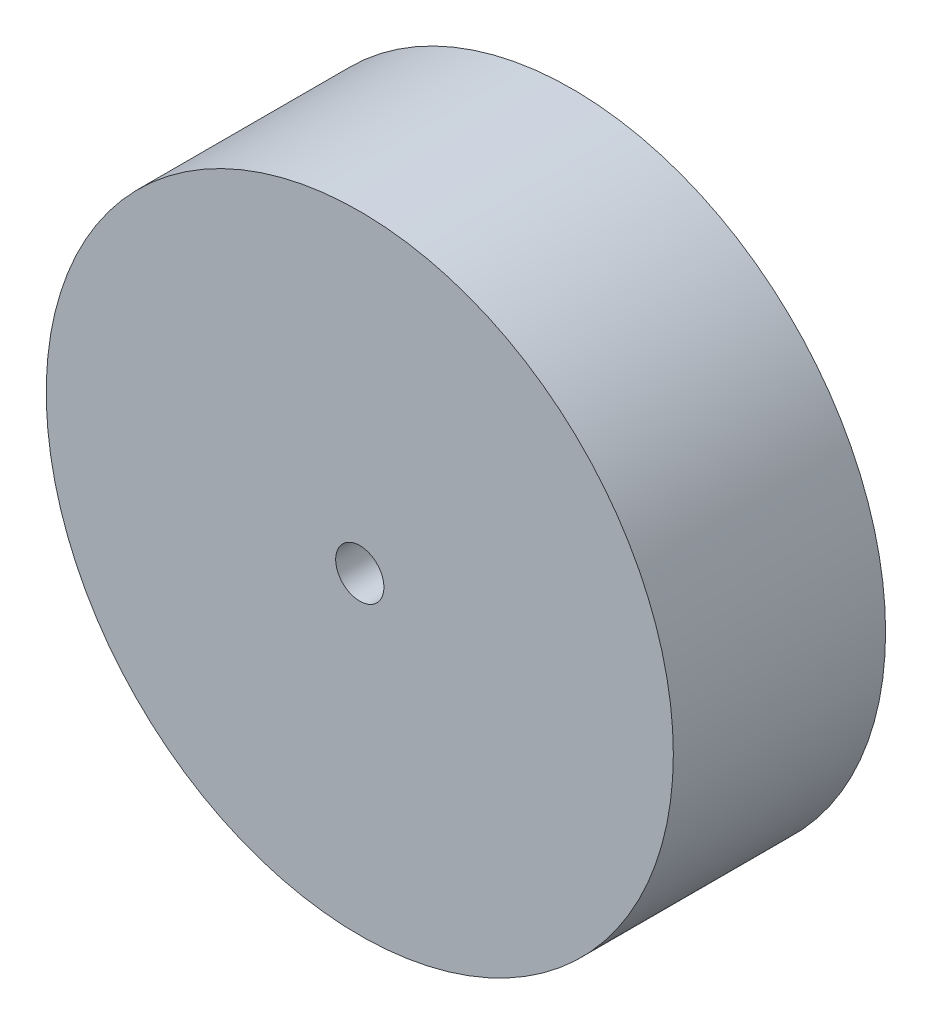
from build123d import *

# Parameters (mm, degrees)
SKETCH1_R           = 32.5
SKETCH1_R_2         = 2.5
BOSS_EXTRUDE1_DEPTH = 22


with BuildPart() as part:
    # Sketch1 → Boss-Extrude1 (new body)
    with BuildSketch(Plane.XY):
        Circle(SKETCH1_R)
        Circle(SKETCH1_R_2, mode=Mode.SUBTRACT)
    extrude(amount=BOSS_EXTRUDE1_DEPTH)


solid = part.part
